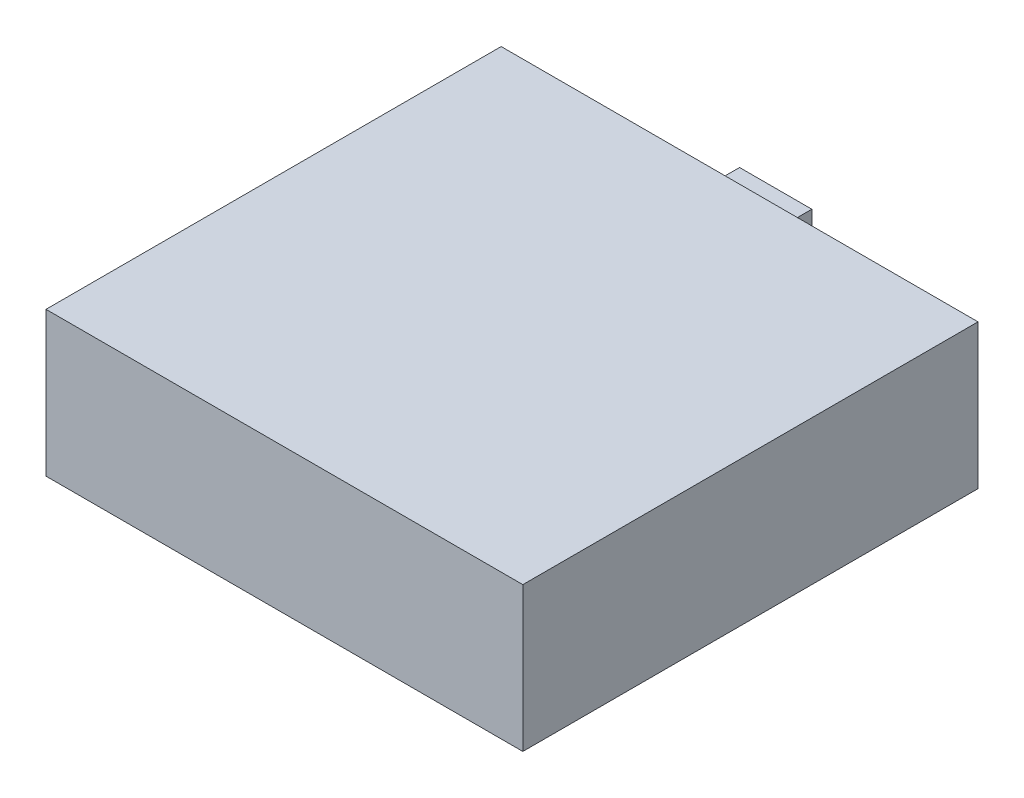
from build123d import *

# Parameters (mm, degrees)
SKETCH1_W           = 66
SKETCH1_H           = 63
BOSS_EXTRUDE1_DEPTH = 20
SKETCH2_W           = 10
SKETCH2_H           = 4
BOSS_EXTRUDE2_DEPTH = 5


with BuildPart() as part:
    # Sketch1 → Boss-Extrude1 (new body)
    with BuildSketch(Plane(origin=(0, 0, 0), x_dir=(1, 0, 0), z_dir=(0, 1, 0))):
        Rectangle(SKETCH1_W, SKETCH1_H)
    extrude(amount=BOSS_EXTRUDE1_DEPTH)

    # Sketch2 → Boss-Extrude2 (add)
    with BuildSketch(Plane(origin=(0, 0, -31.5), x_dir=(-1, 0, 0), z_dir=(0, 0, -1))):
        with Locations((0, 15)):
            Rectangle(SKETCH2_W, SKETCH2_H)
    extrude(amount=BOSS_EXTRUDE2_DEPTH)


solid = part.part
